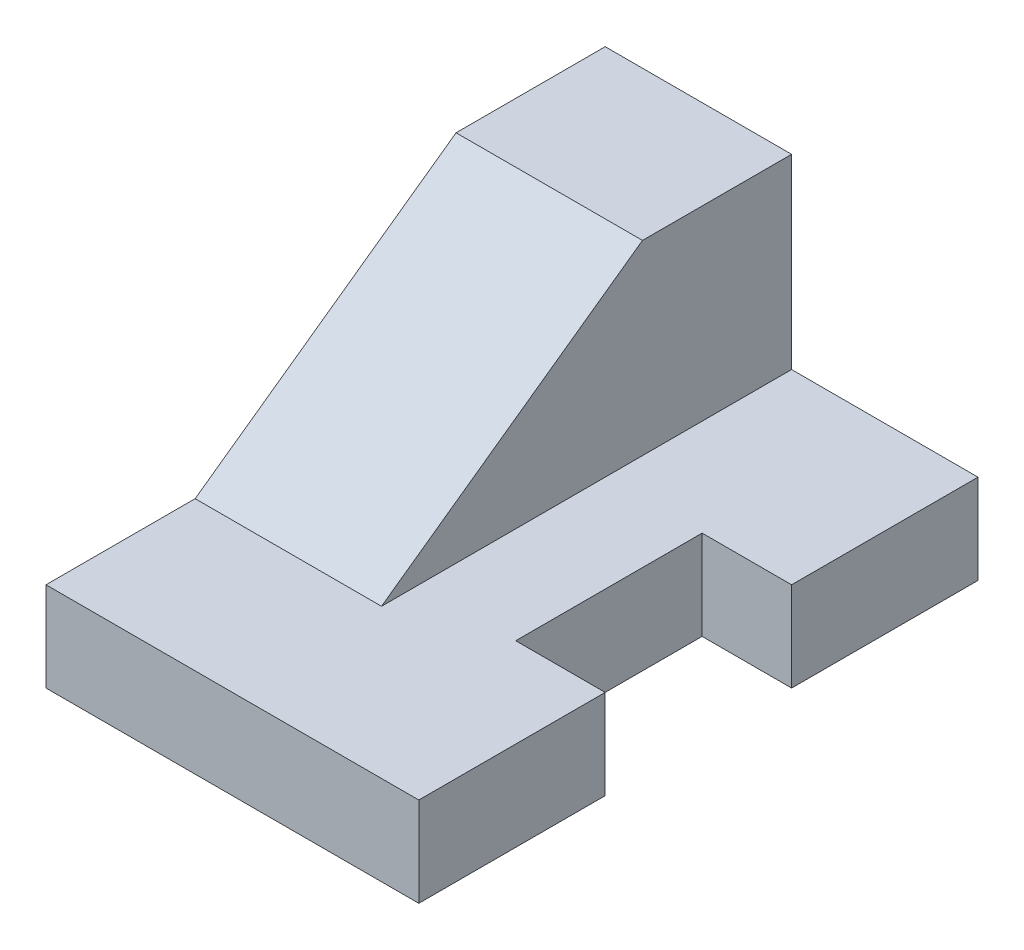
from build123d import *

# Parameters (mm, degrees)
SKETCH1_W             = 25
SKETCH1_H             = 12
BOSS_EXTRUDE2_DEPTH   = 50
BOSS_EXTRUDE2_2_DEPTH = 50
SKETCH1_4_W           = 25
SKETCH1_4_H           = 12
BOSS_EXTRUDE3_DEPTH   = 38
BOSS_EXTRUDE4_DEPTH   = 25


with BuildPart() as part:
    # Sketch1 → Boss-Extrude2 (new body)
    with BuildSketch(Plane(origin=(0, 0, 0), x_dir=(0, 0, -1), z_dir=(1, 0, 0))):
        with Locations((-12.5, 6)):
            Rectangle(SKETCH1_W, SKETCH1_H)
    extrude(amount=BOSS_EXTRUDE2_DEPTH)



with BuildPart() as body_2:
    # Sketch1 → Boss-Extrude2 2 (new body)
    with BuildSketch(Plane(origin=(0, 0, 0), x_dir=(0, 0, -1), z_dir=(1, 0, 0))):
        with Locations((-62.5, 6)):
            Rectangle(SKETCH1_W, SKETCH1_H)
    extrude(amount=BOSS_EXTRUDE2_2_DEPTH)


with BuildPart() as part_1:
    add(part.part)

    add(body_2.part)  # Boss-Extrude3 merges body 2
    # Sketch1<4> → Boss-Extrude3 (add)
    with BuildSketch(Plane(origin=(0, 0, 0), x_dir=(0, 0, -1), z_dir=(1, 0, 0))):
        with Locations((-37.5, 6)):
            Rectangle(SKETCH1_4_W, SKETCH1_4_H)
    extrude(amount=BOSS_EXTRUDE3_DEPTH)

    # Sketch1<5> → Boss-Extrude4 (add)
    with BuildSketch(Plane(origin=(0, 0, 0), x_dir=(0, 0, -1), z_dir=(1, 0, 0))):
        Polygon((-25, 12), (0, 12), (0, 37), (-20, 37), (-55, 12), (-50, 12), align=None)
    extrude(amount=BOSS_EXTRUDE4_DEPTH)


solid = part_1.part
